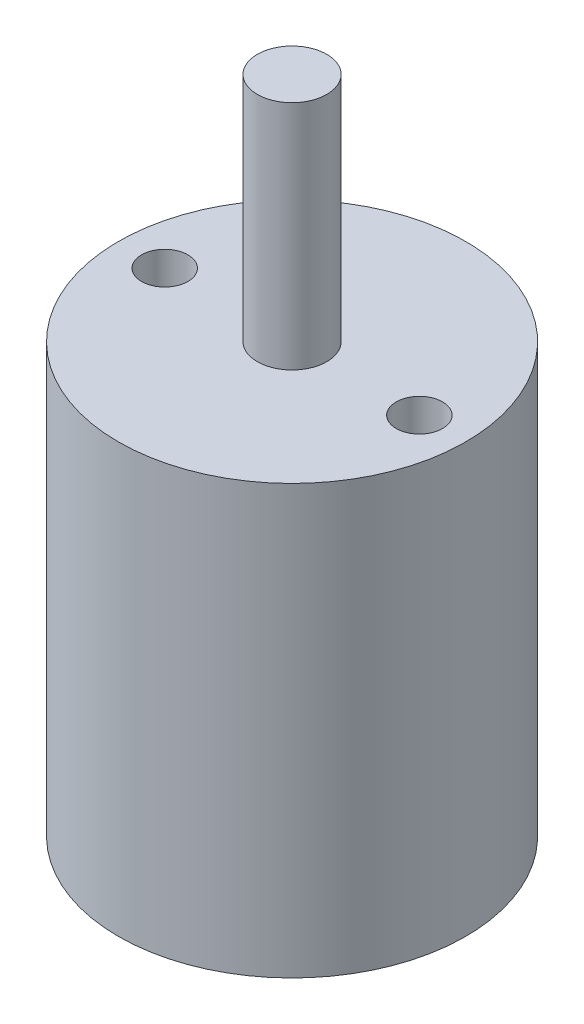
from build123d import *

# Parameters (mm, degrees)
SKETCH_1_R          = 7.5
EXTRUDE_1_DEPTH     = 18.5
SKETCH_2_R          = 1.5
EXTRUDE_2_DEPTH     = 10
SKETCH_3_R          = 1
CUT_EXTRUDE_1_DEPTH = 10


with BuildPart() as part:
    # 草图1 → 凸台-拉伸1 (new body)
    with BuildSketch(Plane(origin=(0, 0, 0), x_dir=(1, 0, 0), z_dir=(0, 1, 0))):
        with Locations(Location((0, 0, 0), (0, 0, 270))):
            Circle(SKETCH_1_R)
    extrude(amount=EXTRUDE_1_DEPTH)

    # 草图2 → 凸台-拉伸2 (add)
    with BuildSketch(Plane(origin=(0, 18.5, 0), x_dir=(1, 0, 0), z_dir=(0, 1, 0))):
        with Locations(Location((0, 0, 0), (0, 0, 270))):
            Circle(SKETCH_2_R)
    extrude(amount=EXTRUDE_2_DEPTH)

    # 草图3 → 切除-拉伸1 (cut)
    with BuildSketch(Plane(origin=(0, 18.5, 0), x_dir=(1, 0, 0), z_dir=(0, 1, 0))):
        with Locations(Location((-5.5, 0, 0), (0, 0, 270))):
            Circle(SKETCH_3_R)
        with Locations(Location((5.5, 0, 0), (0, 0, 270))):
            Circle(SKETCH_3_R)
    extrude(amount=-CUT_EXTRUDE_1_DEPTH, mode=Mode.SUBTRACT)


solid = part.part
